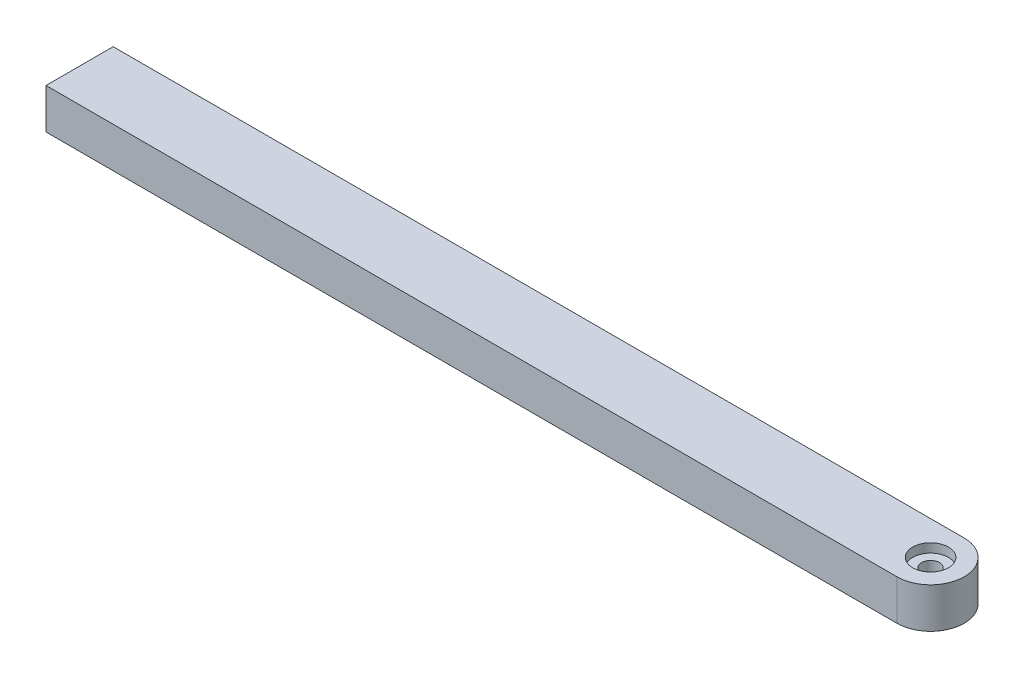
from build123d import *

# Parameters (mm, degrees)
SKETCH1_R           = 4
BOSS_EXTRUDE1_DEPTH = 18
SKETCH2_R           = 8
CUT_EXTRUDE1_DEPTH  = 4


with BuildPart() as part:
    # Sketch1 → Boss-Extrude1 (new body)
    with BuildSketch(Plane(origin=(0, 0, 0), x_dir=(1, 0, 0), z_dir=(0, 1, 0))):
        with BuildLine():
            Line((-200, 15), (-200, -15))
            Line((-200, -15), (180, -15))
            ThreePointArc((180, -15), (195, 0), (180, 15))
            Line((180, 15), (-200, 15))
        make_face()
        with Locations(Location((180, 0, 0), (0, 0, 270))):
            Circle(SKETCH1_R, mode=Mode.SUBTRACT)
    extrude(amount=BOSS_EXTRUDE1_DEPTH)

    # Sketch2 → Cut-Extrude1 (cut)
    with BuildSketch(Plane(origin=(0, 18, 0), x_dir=(1, 0, 0), z_dir=(0, 1, 0))):
        with Locations(Location((180, 0, 0), (0, 0, 270))):
            Circle(SKETCH2_R)
    extrude(amount=-CUT_EXTRUDE1_DEPTH, mode=Mode.SUBTRACT)


solid = part.part
